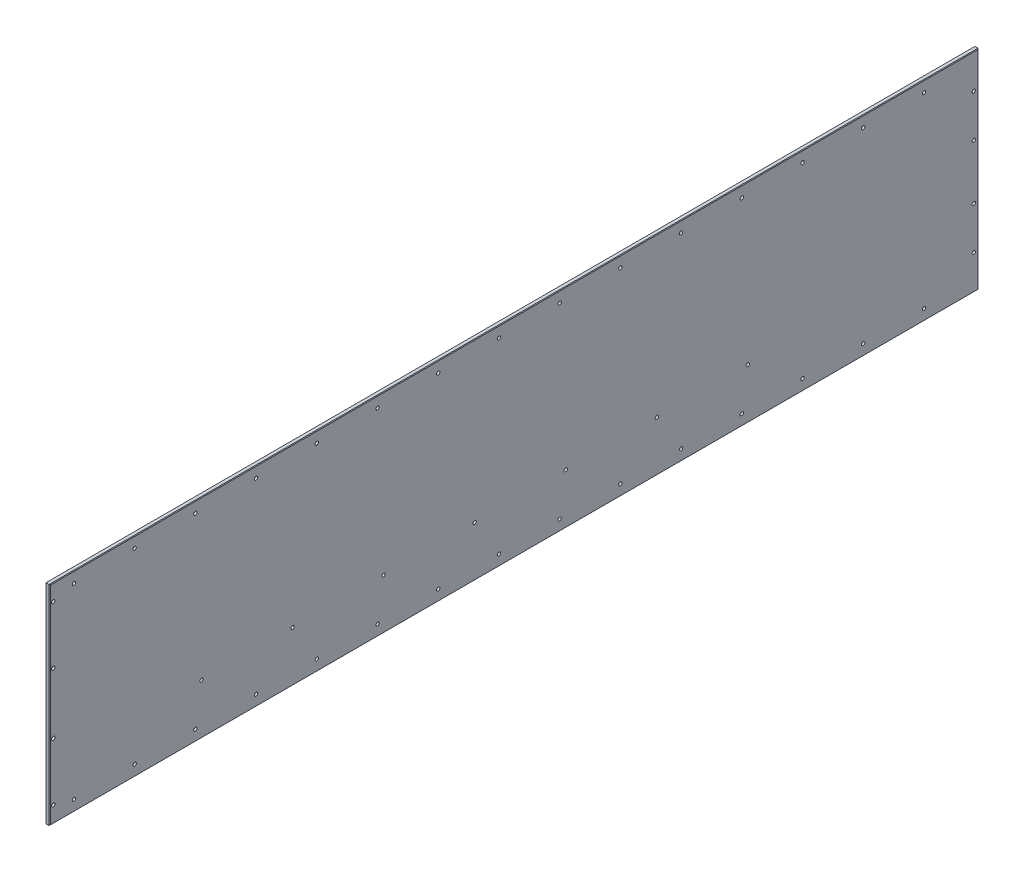
from build123d import *

# Parameters (mm, degrees)
SKETCH1_W                                            = 1530
SKETCH1_H                                            = 344
BOSS_EXTRUDE1_DEPTH                                  = 6
FASE1_SIZE                                           = 1
CSK_FOR_M5_COUNTERSUNK_RAISED_HEAD_SCREW_D           = 5.5
CSK_FOR_M5_COUNTERSUNK_RAISED_HEAD_SCREW_CSINK_D     = 10.4
CSK_FOR_M5_COUNTERSUNK_RAISED_HEAD_SCREW_CSINK_ANGLE = 90
CSK_FOR_M5_COUNTERSUNK_RAISED_HEAD_S_2_D             = 5.5
CSK_FOR_M5_COUNTERSUNK_RAISED_HEAD_S_2_CSINK_D       = 10.4
CSK_FOR_M5_COUNTERSUNK_RAISED_HEAD_S_2_CSINK_ANGLE   = 90
LPATTERN1_COUNT                                      = 15
LPATTERN1_PITCH                                      = 100
SPIEGELN1_COPY_1_D                                   = 5.5
SPIEGELN1_COPY_1_CSINK_D                             = 10.4
SPIEGELN1_COPY_1_CSINK_ANGLE                         = 90
SPIEGELN1_COPY_2_D                                   = 5.5
SPIEGELN1_COPY_2_CSINK_D                             = 10.4
SPIEGELN1_COPY_2_CSINK_ANGLE                         = 90
SPIEGELN1_COPY_3_D                                   = 5.5
SPIEGELN1_COPY_3_CSINK_D                             = 10.4
SPIEGELN1_COPY_3_CSINK_ANGLE                         = 90
SPIEGELN1_COPY_4_D                                   = 5.5
SPIEGELN1_COPY_4_CSINK_D                             = 10.4
SPIEGELN1_COPY_4_CSINK_ANGLE                         = 90
SPIEGELN1_COPY_5_D                                   = 5.5
SPIEGELN1_COPY_5_CSINK_D                             = 10.4
SPIEGELN1_COPY_5_CSINK_ANGLE                         = 90
SPIEGELN1_COPY_6_D                                   = 5.5
SPIEGELN1_COPY_6_CSINK_D                             = 10.4
SPIEGELN1_COPY_6_CSINK_ANGLE                         = 90
SPIEGELN1_COPY_7_D                                   = 5.5
SPIEGELN1_COPY_7_CSINK_D                             = 10.4
SPIEGELN1_COPY_7_CSINK_ANGLE                         = 90
SPIEGELN1_COPY_8_D                                   = 5.5
SPIEGELN1_COPY_8_CSINK_D                             = 10.4
SPIEGELN1_COPY_8_CSINK_ANGLE                         = 90
SPIEGELN1_COPY_9_D                                   = 5.5
SPIEGELN1_COPY_9_CSINK_D                             = 10.4
SPIEGELN1_COPY_9_CSINK_ANGLE                         = 90
SPIEGELN1_COPY_10_D                                  = 5.5
SPIEGELN1_COPY_10_CSINK_D                            = 10.4
SPIEGELN1_COPY_10_CSINK_ANGLE                        = 90
SPIEGELN1_COPY_11_D                                  = 5.5
SPIEGELN1_COPY_11_CSINK_D                            = 10.4
SPIEGELN1_COPY_11_CSINK_ANGLE                        = 90
SPIEGELN1_COPY_12_D                                  = 5.5
SPIEGELN1_COPY_12_CSINK_D                            = 10.4
SPIEGELN1_COPY_12_CSINK_ANGLE                        = 90
SPIEGELN1_COPY_13_D                                  = 5.5
SPIEGELN1_COPY_13_CSINK_D                            = 10.4
SPIEGELN1_COPY_13_CSINK_ANGLE                        = 90
SPIEGELN1_COPY_14_D                                  = 5.5
SPIEGELN1_COPY_14_CSINK_D                            = 10.4
SPIEGELN1_COPY_14_CSINK_ANGLE                        = 90
CSK_FOR_M5_COUNTERSUNK_RAISED_HEAD_S_3_D             = 5.5
CSK_FOR_M5_COUNTERSUNK_RAISED_HEAD_S_3_CSINK_D       = 10.4
CSK_FOR_M5_COUNTERSUNK_RAISED_HEAD_S_3_CSINK_ANGLE   = 90
LINEARES_MUSTER1_COUNT                               = 7
LINEARES_MUSTER1_PITCH                               = 150


with BuildPart() as part:
    # Sketch1 → Boss-Extrude1 (new body)
    with BuildSketch(Plane(origin=(0, 0, 0), x_dir=(0, 0, -1), z_dir=(1, 0, 0))):
        Rectangle(SKETCH1_W, SKETCH1_H)
    extrude(amount=BOSS_EXTRUDE1_DEPTH)

    # Fase1
    fase1_edges = [part.edges().sort_by_distance(p)[0] for p in [
        (6, 0, -765),
        (6, 172, 0),
        (6, 0, 765),
        (6, -172, 0),
    ]]
    chamfer(fase1_edges, length=FASE1_SIZE)

    # CSK for M5 Countersunk Raised Head Screw (through all)
    with Locations(Plane.ZY):
        with Locations((-757, 115), (-757, 45), (759, 145), (759, 50)):
            csk_for_m5_countersunk_raised_head_screw = CounterSinkHole(CSK_FOR_M5_COUNTERSUNK_RAISED_HEAD_SCREW_D / 2, CSK_FOR_M5_COUNTERSUNK_RAISED_HEAD_SCREW_CSINK_D / 2, counter_sink_angle=CSK_FOR_M5_COUNTERSUNK_RAISED_HEAD_SCREW_CSINK_ANGLE)

    # CSK for M5 Countersunk Raised Head S 2 (through all)
    with Locations(Plane.ZY):
        with Locations((725, 154)):
            csk_for_m5_countersunk_raised_head_s_2 = CounterSinkHole(CSK_FOR_M5_COUNTERSUNK_RAISED_HEAD_S_2_D / 2, CSK_FOR_M5_COUNTERSUNK_RAISED_HEAD_S_2_CSINK_D / 2, counter_sink_angle=CSK_FOR_M5_COUNTERSUNK_RAISED_HEAD_S_2_CSINK_ANGLE)

    # LPattern1: CSK for M5 Countersunk Raised Head S 2 ×15
    with Locations(*[(0, 0, -i * LPATTERN1_PITCH) for i in range(1, LPATTERN1_COUNT)]):
        add(csk_for_m5_countersunk_raised_head_s_2, mode=Mode.SUBTRACT)

    # Spiegeln1: CSK for M5 Countersunk Raised Head Screw, CSK for M5 Countersunk Raised Head S 2 across plane
    add(csk_for_m5_countersunk_raised_head_screw.mirror(Plane.ZX), mode=Mode.SUBTRACT)
    add(csk_for_m5_countersunk_raised_head_s_2.mirror(Plane.ZX), mode=Mode.SUBTRACT)

    # Spiegeln1 copy 1 (through all)
    with Locations(Plane(origin=(0, 0, -100), x_dir=(0, 0, 1), z_dir=(-1, 0, 0))):
        with Locations((725, -154)):
            CounterSinkHole(SPIEGELN1_COPY_1_D / 2, SPIEGELN1_COPY_1_CSINK_D / 2, counter_sink_angle=SPIEGELN1_COPY_1_CSINK_ANGLE)

    # Spiegeln1 copy 2 (through all)
    with Locations(Plane(origin=(0, 0, -200), x_dir=(0, 0, 1), z_dir=(-1, 0, 0))):
        with Locations((725, -154)):
            CounterSinkHole(SPIEGELN1_COPY_2_D / 2, SPIEGELN1_COPY_2_CSINK_D / 2, counter_sink_angle=SPIEGELN1_COPY_2_CSINK_ANGLE)

    # Spiegeln1 copy 3 (through all)
    with Locations(Plane(origin=(0, 0, -300), x_dir=(0, 0, 1), z_dir=(-1, 0, 0))):
        with Locations((725, -154)):
            CounterSinkHole(SPIEGELN1_COPY_3_D / 2, SPIEGELN1_COPY_3_CSINK_D / 2, counter_sink_angle=SPIEGELN1_COPY_3_CSINK_ANGLE)

    # Spiegeln1 copy 4 (through all)
    with Locations(Plane(origin=(0, 0, -400), x_dir=(0, 0, 1), z_dir=(-1, 0, 0))):
        with Locations((725, -154)):
            CounterSinkHole(SPIEGELN1_COPY_4_D / 2, SPIEGELN1_COPY_4_CSINK_D / 2, counter_sink_angle=SPIEGELN1_COPY_4_CSINK_ANGLE)

    # Spiegeln1 copy 5 (through all)
    with Locations(Plane(origin=(0, 0, -500), x_dir=(0, 0, 1), z_dir=(-1, 0, 0))):
        with Locations((725, -154)):
            CounterSinkHole(SPIEGELN1_COPY_5_D / 2, SPIEGELN1_COPY_5_CSINK_D / 2, counter_sink_angle=SPIEGELN1_COPY_5_CSINK_ANGLE)

    # Spiegeln1 copy 6 (through all)
    with Locations(Plane(origin=(0, 0, -600), x_dir=(0, 0, 1), z_dir=(-1, 0, 0))):
        with Locations((725, -154)):
            CounterSinkHole(SPIEGELN1_COPY_6_D / 2, SPIEGELN1_COPY_6_CSINK_D / 2, counter_sink_angle=SPIEGELN1_COPY_6_CSINK_ANGLE)

    # Spiegeln1 copy 7 (through all)
    with Locations(Plane(origin=(0, 0, -700), x_dir=(0, 0, 1), z_dir=(-1, 0, 0))):
        with Locations((725, -154)):
            CounterSinkHole(SPIEGELN1_COPY_7_D / 2, SPIEGELN1_COPY_7_CSINK_D / 2, counter_sink_angle=SPIEGELN1_COPY_7_CSINK_ANGLE)

    # Spiegeln1 copy 8 (through all)
    with Locations(Plane(origin=(0, 0, -800), x_dir=(0, 0, 1), z_dir=(-1, 0, 0))):
        with Locations((725, -154)):
            CounterSinkHole(SPIEGELN1_COPY_8_D / 2, SPIEGELN1_COPY_8_CSINK_D / 2, counter_sink_angle=SPIEGELN1_COPY_8_CSINK_ANGLE)

    # Spiegeln1 copy 9 (through all)
    with Locations(Plane(origin=(0, 0, -900), x_dir=(0, 0, 1), z_dir=(-1, 0, 0))):
        with Locations((725, -154)):
            CounterSinkHole(SPIEGELN1_COPY_9_D / 2, SPIEGELN1_COPY_9_CSINK_D / 2, counter_sink_angle=SPIEGELN1_COPY_9_CSINK_ANGLE)

    # Spiegeln1 copy 10 (through all)
    with Locations(Plane(origin=(0, 0, -1000), x_dir=(0, 0, 1), z_dir=(-1, 0, 0))):
        with Locations((725, -154)):
            CounterSinkHole(SPIEGELN1_COPY_10_D / 2, SPIEGELN1_COPY_10_CSINK_D / 2, counter_sink_angle=SPIEGELN1_COPY_10_CSINK_ANGLE)

    # Spiegeln1 copy 11 (through all)
    with Locations(Plane(origin=(0, 0, -1100), x_dir=(0, 0, 1), z_dir=(-1, 0, 0))):
        with Locations((725, -154)):
            CounterSinkHole(SPIEGELN1_COPY_11_D / 2, SPIEGELN1_COPY_11_CSINK_D / 2, counter_sink_angle=SPIEGELN1_COPY_11_CSINK_ANGLE)

    # Spiegeln1 copy 12 (through all)
    with Locations(Plane(origin=(0, 0, -1200), x_dir=(0, 0, 1), z_dir=(-1, 0, 0))):
        with Locations((725, -154)):
            CounterSinkHole(SPIEGELN1_COPY_12_D / 2, SPIEGELN1_COPY_12_CSINK_D / 2, counter_sink_angle=SPIEGELN1_COPY_12_CSINK_ANGLE)

    # Spiegeln1 copy 13 (through all)
    with Locations(Plane(origin=(0, 0, -1300), x_dir=(0, 0, 1), z_dir=(-1, 0, 0))):
        with Locations((725, -154)):
            CounterSinkHole(SPIEGELN1_COPY_13_D / 2, SPIEGELN1_COPY_13_CSINK_D / 2, counter_sink_angle=SPIEGELN1_COPY_13_CSINK_ANGLE)

    # Spiegeln1 copy 14 (through all)
    with Locations(Plane(origin=(0, 0, -1400), x_dir=(0, 0, 1), z_dir=(-1, 0, 0))):
        with Locations((725, -154)):
            CounterSinkHole(SPIEGELN1_COPY_14_D / 2, SPIEGELN1_COPY_14_CSINK_D / 2, counter_sink_angle=SPIEGELN1_COPY_14_CSINK_ANGLE)

    # CSK for M5 Countersunk Raised Head S 3 (through all)
    with Locations(Plane.ZY):
        with Locations((515, -89)):
            csk_for_m5_countersunk_raised_head_s_3 = CounterSinkHole(CSK_FOR_M5_COUNTERSUNK_RAISED_HEAD_S_3_D / 2, CSK_FOR_M5_COUNTERSUNK_RAISED_HEAD_S_3_CSINK_D / 2, counter_sink_angle=CSK_FOR_M5_COUNTERSUNK_RAISED_HEAD_S_3_CSINK_ANGLE)

    # Lineares Muster1: CSK for M5 Countersunk Raised Head S 3 ×7
    with Locations(*[(0, 0, -i * LINEARES_MUSTER1_PITCH) for i in range(1, LINEARES_MUSTER1_COUNT)]):
        add(csk_for_m5_countersunk_raised_head_s_3, mode=Mode.SUBTRACT)


solid = part.part
